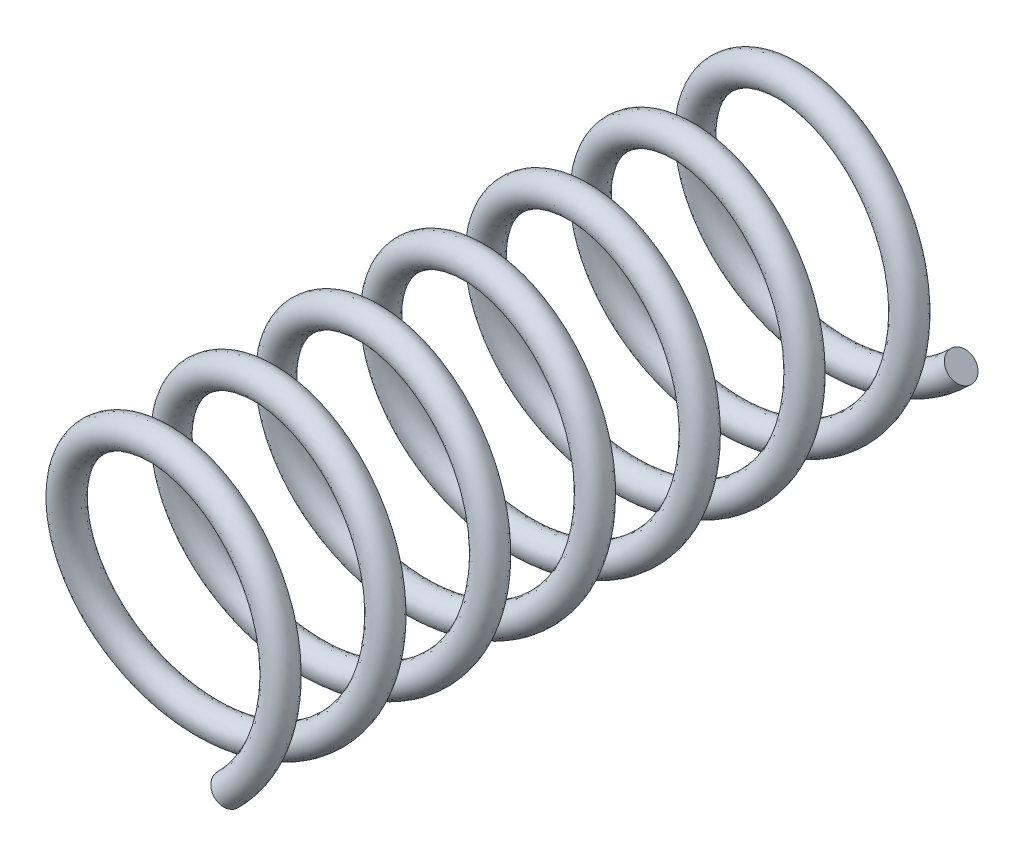
from build123d import *

# Parameters (mm, degrees)
BARRER1_PITCH       = 7.142857143
BARRER1_HEIGHT      = 50
BARRER1_RADIUS      = 9
BARRER1_START_ANGLE = -45
BARRER1_PROFILE_R   = 1


with BuildPart() as part:
    # Barrer1: sweep along a helix
    with BuildLine() as barrer1_path:
        add(Helix(BARRER1_PITCH, BARRER1_HEIGHT, BARRER1_RADIUS, center=(0, 0, 0), direction=(0, 0, 1), lefthand=True, mode=Mode.PRIVATE).rotate(Axis((0, 0, 0), (0, 0, 1)), BARRER1_START_ANGLE))
    # Barrer1 profile (on start of the path) → Barrer1 (sweep)
    with BuildSketch(Plane(origin=(6.363961031, -6.363961031, 0), x_dir=(-0.7071067811867103, 0.7071067811863848, 0), z_dir=(-0.7015324226688445, -0.7015324226691674, 0.1253176758813791))):
        Circle(BARRER1_PROFILE_R)
    sweep(path=barrer1_path.line, is_frenet=True)


solid = part.part
